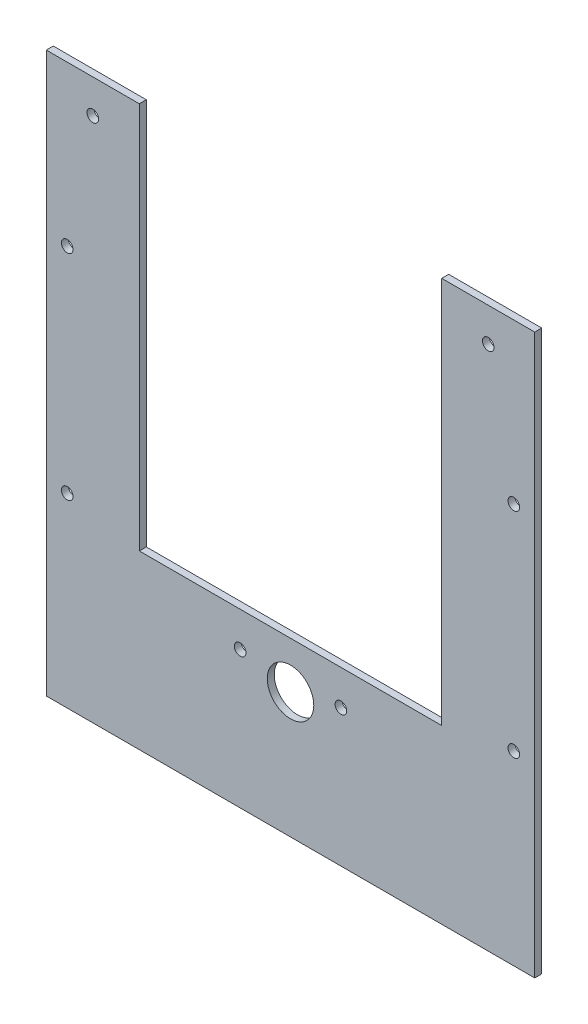
from build123d import *

# Parameters (mm, degrees)
CROQUIS1_R              = 2.5
CROQUIS1_R_2            = 10
SALIENTE_EXTRUIR1_DEPTH = 3


with BuildPart() as part:
    # Croquis1 → Saliente-Extruir1 (new body)
    with BuildSketch(Plane.XY):
        Polygon((-79.498385096, 944.128389678), (-79.498385096, 777.628389678), (50.501614904, 777.628389678), (50.501614904, 944.128389678), (90.501614904, 944.128389678), (90.501614904, 703.628389678), (-119.498385096, 703.628389678), (-119.498385096, 944.128389678), align=None)
        with Locations((70.501614904, 929.628389678)):
            Circle(CROQUIS1_R, mode=Mode.SUBTRACT)
        with Locations((81.501614904, 875.618389678)):
            Circle(CROQUIS1_R, mode=Mode.SUBTRACT)
        with Locations((81.501614904, 783.618389678)):
            Circle(CROQUIS1_R, mode=Mode.SUBTRACT)
        with Locations((-36.165051763, 762.628389678)):
            Circle(CROQUIS1_R, mode=Mode.SUBTRACT)
        with Locations((-110.498385096, 783.618389678)):
            Circle(CROQUIS1_R, mode=Mode.SUBTRACT)
        with Locations((-110.498385096, 875.618389678)):
            Circle(CROQUIS1_R, mode=Mode.SUBTRACT)
        with Locations((-99.498385096, 929.628389678)):
            Circle(CROQUIS1_R, mode=Mode.SUBTRACT)
        with Locations((7.168281571, 762.628389678)):
            Circle(CROQUIS1_R, mode=Mode.SUBTRACT)
        with Locations((-14.498385096, 757.628389678)):
            Circle(CROQUIS1_R_2, mode=Mode.SUBTRACT)
    extrude(amount=SALIENTE_EXTRUIR1_DEPTH)


solid = part.part
